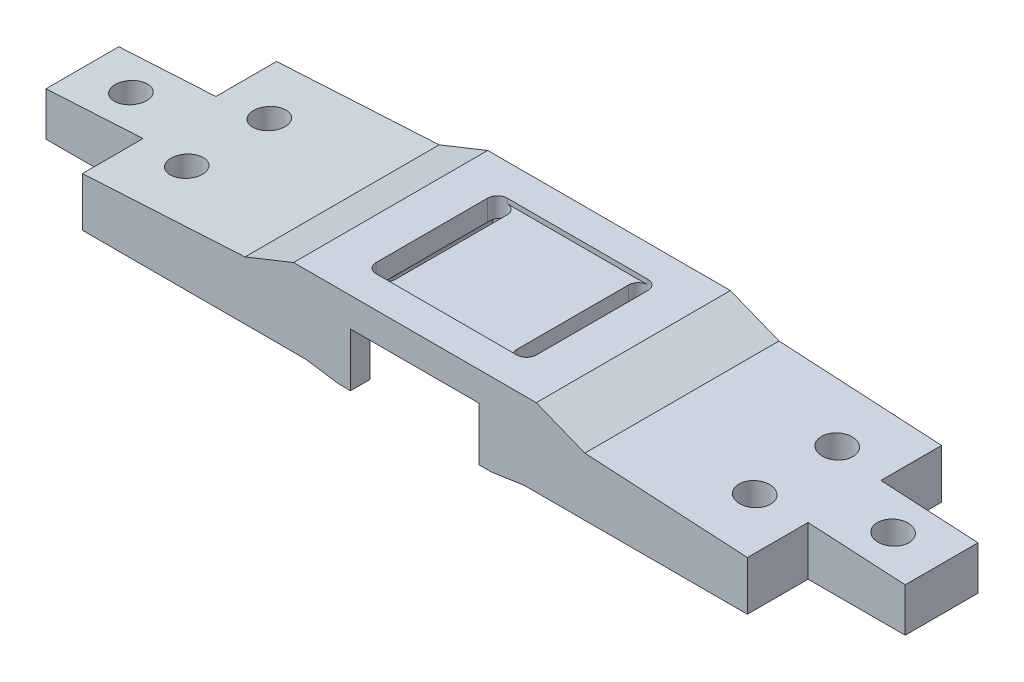
from build123d import *

# Parameters (mm, degrees)
SKETCH1_R                      = 1.8
BOSS_EXTRUDE1_DEPTH            = 6
BOSS_EXTRUDE2_DEPTH            = 40
CUT_EXTRUDE1_REACH             = 93.281
SKETCH3_W                      = 20
SKETCH3_H                      = 12.5
SKETCH4_R                      = 3.25
CUT_EXTRUDE2_DEPTH             = 12
CUT_EXTRUDE3_REACH             = 100.429
CUT_EXTRUDE4_START             = -2
SKETCH6_W                      = 35
SKETCH6_H                      = 27
CUT_EXTRUDE4_DEPTH             = 4.307692
FILLET1_R                      = 2
BOSS_EXTRUDE3_DEPTH            = 4
CUT_EXTRUDE5_REACH             = 93.658
CUT_EXTRUDE5_DIRECTION_2_REACH = 93.658
SKETCH10_W                     = 29
SKETCH10_H                     = 27
CUT_EXTRUDE7_DEPTH             = 1


with BuildPart() as part:
    # Sketch1 → Boss-Extrude1 (new body)
    with BuildSketch(Plane(origin=(0, 0, 0), x_dir=(1, 0, 0), z_dir=(0, 1, 0))):
        Polygon((68.5, 20), (68.5, 7.5), (88.5, 7.5), (88.5, -7.5), (68.5, -7.5), (68.5, -20), (-68.5, -20), (-68.5, -7.5), (-88.5, -7.5), (-88.5, 7.5), (-68.5, 7.5), (-68.5, 20), align=None)
        with Locations(Location((-78.5, 0, 0), (0, 0, 270))):
            Circle(SKETCH1_R, mode=Mode.SUBTRACT)
        with Locations(Location((-58.5, 8.5, 0), (0, 0, 270))):
            Circle(SKETCH1_R, mode=Mode.SUBTRACT)
        with Locations(Location((-58.5, -8.5, 0), (0, 0, 270))):
            Circle(SKETCH1_R, mode=Mode.SUBTRACT)
        with Locations(Location((58.5, -8.5, 0), (0, 0, 90))):
            Circle(SKETCH1_R, mode=Mode.SUBTRACT)
        with Locations(Location((78.5, 0, 0), (0, 0, 90))):
            Circle(SKETCH1_R, mode=Mode.SUBTRACT)
        with Locations(Location((58.5, 8.5, 0), (0, 0, 90))):
            Circle(SKETCH1_R, mode=Mode.SUBTRACT)
    extrude(amount=BOSS_EXTRUDE1_DEPTH)

    # Sketch2 → Boss-Extrude2 (add)
    with BuildSketch(Plane(origin=(0, 0, -20), x_dir=(-1, 0, 0), z_dir=(0, 0, -1))):
        Polygon((-88.5, 6), (88.5, 6), (88.5, 9), (35, 12), (25, 16), (-25, 16), (-35, 12), (-88.5, 9), align=None)
    extrude(amount=-BOSS_EXTRUDE2_DEPTH)

    # Sketch3 → Cut-Extrude1 (cut, up to next)
    with BuildSketch(Plane.XZ.offset(-6), mode=Mode.PRIVATE) as cut_extrude1_sk1:
        with Locations((-78.5, 13.75)):
            Rectangle(SKETCH3_W, SKETCH3_H)
    cut_extrude1_tool1 = extrude(cut_extrude1_sk1.sketch, amount=-CUT_EXTRUDE1_REACH, mode=Mode.PRIVATE) & part.part
    # Sketch3 → Cut-Extrude1 (cut, up to next)
    with BuildSketch(Plane.XZ.offset(-6), mode=Mode.PRIVATE) as cut_extrude1_sk2:
        with Locations((-78.5, -13.75)):
            Rectangle(SKETCH3_W, SKETCH3_H)
    cut_extrude1_tool2 = extrude(cut_extrude1_sk2.sketch, amount=-CUT_EXTRUDE1_REACH, mode=Mode.PRIVATE) & part.part
    # Sketch3 → Cut-Extrude1 (cut, up to next)
    with BuildSketch(Plane.XZ.offset(-6), mode=Mode.PRIVATE) as cut_extrude1_sk3:
        with Locations((78.5, 13.75)):
            Rectangle(SKETCH3_W, SKETCH3_H)
    cut_extrude1_tool3 = extrude(cut_extrude1_sk3.sketch, amount=-CUT_EXTRUDE1_REACH, mode=Mode.PRIVATE) & part.part
    # Sketch3 → Cut-Extrude1 (cut, up to next)
    with BuildSketch(Plane.XZ.offset(-6), mode=Mode.PRIVATE) as cut_extrude1_sk4:
        with Locations((78.5, -13.75)):
            Rectangle(SKETCH3_W, SKETCH3_H)
    cut_extrude1_tool4 = extrude(cut_extrude1_sk4.sketch, amount=-CUT_EXTRUDE1_REACH, mode=Mode.PRIVATE) & part.part
    add(cut_extrude1_tool1.solids().sort_by_distance((-78.5, 6, 13.75))[0], mode=Mode.SUBTRACT)
    add(cut_extrude1_tool2.solids().sort_by_distance((-78.5, 6, -13.75))[0], mode=Mode.SUBTRACT)
    add(cut_extrude1_tool3.solids().sort_by_distance((78.5, 6, 13.75))[0], mode=Mode.SUBTRACT)
    add(cut_extrude1_tool4.solids().sort_by_distance((78.5, 6, -13.75))[0], mode=Mode.SUBTRACT)

    # Sketch4 → Cut-Extrude2 (cut)
    with BuildSketch(Plane(origin=(0, 16, 0), x_dir=(1, 0, 0), z_dir=(0, 1, 0))):
        with Locations(Location((-58.5, 8.5, 0), (0, 0, 180))):
            Circle(SKETCH4_R)
        with Locations(Location((-78.5, 0, 0), (0, 0, 180))):
            Circle(SKETCH4_R)
        with Locations(Location((-58.5, -8.5, 0), (0, 0, 180))):
            Circle(SKETCH4_R)
        with Locations(Location((58.5, 8.5, 0), (0, 0, 180))):
            Circle(SKETCH4_R)
        with Locations(Location((58.5, -8.5, 0), (0, 0, 180))):
            Circle(SKETCH4_R)
        with Locations(Location((78.5, 0, 0), (0, 0, 180))):
            Circle(SKETCH4_R)
    extrude(amount=-CUT_EXTRUDE2_DEPTH, mode=Mode.SUBTRACT)

    # Sketch5 → Cut-Extrude3 (cut, up to next)
    with BuildSketch(Plane(origin=(0, 0, -20), x_dir=(-1, 0, 0), z_dir=(0, 0, -1)), mode=Mode.PRIVATE) as cut_extrude3_sk1:
        Polygon((-22.5, 0), (-16, 10), (16, 10), (22.5, 0), align=None)
    cut_extrude3_tool1 = extrude(cut_extrude3_sk1.sketch, amount=-CUT_EXTRUDE3_REACH, mode=Mode.PRIVATE) & part.part
    add(cut_extrude3_tool1.solids().sort_by_distance((0, 4.718615, -20))[0], mode=Mode.SUBTRACT)

    # Sketch6 → Cut-Extrude4 (cut)
    with BuildSketch(Plane.XZ.offset(-10).offset(CUT_EXTRUDE4_START)):
        Rectangle(SKETCH6_W, SKETCH6_H)
    extrude(amount=CUT_EXTRUDE4_DEPTH, mode=Mode.SUBTRACT)

    # Fillet1
    fillet1_edges = [part.edges().sort_by_distance(p)[0] for p in [
        (-17.5, 12, 0),
        (17.5, 12, 0),
    ]]
    fillet(fillet1_edges, radius=FILLET1_R)

    # Sketch7 → Boss-Extrude3 (add)
    with BuildSketch(Plane(origin=(0, 0, -20), x_dir=(-1, 0, 0), z_dir=(0, 0, -1))):
        Polygon((-22.5, 0), (-15.75, -1), (-13.25, -1), (-13.25, 10), (-16, 10), align=None)
        Polygon((16, 10), (22.5, 0), (15.75, -1), (13.25, -1), (13.25, 10), align=None)
    boss_extrude3 = extrude(amount=-BOSS_EXTRUDE3_DEPTH)

    # Mirror1: Boss-Extrude3 across plane
    add(boss_extrude3.mirror(Plane.XY))

    # Sketch8 → Cut-Extrude5 (cut, up to next)
    with BuildSketch(Plane.XZ.offset(-12), mode=Mode.PRIVATE) as cut_extrude5_sk1:
        with BuildLine():
            Line((-12.5, 11.5), (-12.5, -11.5))
            ThreePointArc((-12.5, -11.5), (-14.5, -13.5), (-16.5, -11.5))
            Line((-16.5, -11.5), (-16.5, 11.5))
            ThreePointArc((-16.5, 11.5), (-14.5, 13.5), (-12.5, 11.5))
        make_face()
    cut_extrude5_tool1 = extrude(cut_extrude5_sk1.sketch, amount=-CUT_EXTRUDE5_REACH, mode=Mode.PRIVATE) & part.part
    # Sketch8 → Cut-Extrude5 (cut, up to next)
    with BuildSketch(Plane.XZ.offset(-12), mode=Mode.PRIVATE) as cut_extrude5_sk2:
        with BuildLine():
            Line((16.5, 11.5), (16.5, -11.5))
            ThreePointArc((16.5, -11.5), (14.5, -13.5), (12.5, -11.5))
            Line((12.5, -11.5), (12.5, 11.5))
            ThreePointArc((12.5, 11.5), (14.5, 13.5), (16.5, 11.5))
        make_face()
    cut_extrude5_tool2 = extrude(cut_extrude5_sk2.sketch, amount=-CUT_EXTRUDE5_REACH, mode=Mode.PRIVATE) & part.part
    add(cut_extrude5_tool1.solids().sort_by_distance((-14.5, 12, 0))[0], mode=Mode.SUBTRACT)
    add(cut_extrude5_tool2.solids().sort_by_distance((14.5, 12, 0))[0], mode=Mode.SUBTRACT)

    # Sketch8 → Cut-Extrude5 direction 2 (cut, up to next)
    with BuildSketch(Plane.XZ.offset(-12), mode=Mode.PRIVATE) as cut_extrude5_direction_2_sk1:
        with BuildLine():
            Line((-12.5, 11.5), (-12.5, -11.5))
            ThreePointArc((-12.5, -11.5), (-14.5, -13.5), (-16.5, -11.5))
            Line((-16.5, -11.5), (-16.5, 11.5))
            ThreePointArc((-16.5, 11.5), (-14.5, 13.5), (-12.5, 11.5))
        make_face()
    cut_extrude5_direction_2_tool1 = extrude(cut_extrude5_direction_2_sk1.sketch, amount=CUT_EXTRUDE5_DIRECTION_2_REACH, mode=Mode.PRIVATE) & part.part
    # Sketch8 → Cut-Extrude5 direction 2 (cut, up to next)
    with BuildSketch(Plane.XZ.offset(-12), mode=Mode.PRIVATE) as cut_extrude5_direction_2_sk2:
        with BuildLine():
            Line((16.5, 11.5), (16.5, -11.5))
            ThreePointArc((16.5, -11.5), (14.5, -13.5), (12.5, -11.5))
            Line((12.5, -11.5), (12.5, 11.5))
            ThreePointArc((12.5, 11.5), (14.5, 13.5), (16.5, 11.5))
        make_face()
    cut_extrude5_direction_2_tool2 = extrude(cut_extrude5_direction_2_sk2.sketch, amount=CUT_EXTRUDE5_DIRECTION_2_REACH, mode=Mode.PRIVATE) & part.part
    add(cut_extrude5_direction_2_tool1.solids().sort_by_distance((-14.5, 12, 0))[0], mode=Mode.SUBTRACT)
    add(cut_extrude5_direction_2_tool2.solids().sort_by_distance((14.5, 12, 0))[0], mode=Mode.SUBTRACT)

    # Sketch10 → Cut-Extrude7 (cut)
    with BuildSketch(Plane(origin=(0, 16, 0), x_dir=(1, 0, 0), z_dir=(0, 1, 0))):
        Rectangle(SKETCH10_W, SKETCH10_H)
    extrude(amount=-CUT_EXTRUDE7_DEPTH, mode=Mode.SUBTRACT)


solid = part.part
